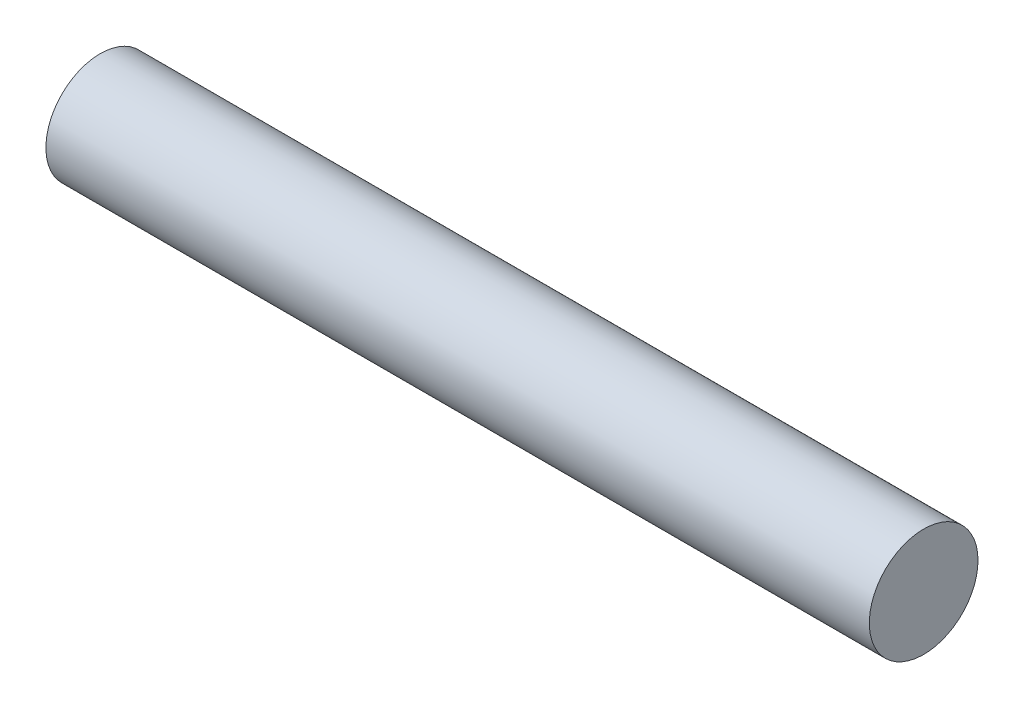
from build123d import *

# Parameters (mm, degrees)
SKETCH_1_R      = 1.65
EXTRUDE_1_DEPTH = 25


with BuildPart() as part:
    # 草图1 → 凸台-拉伸1 (new body)
    with BuildSketch(Plane(origin=(0, 0, 0), x_dir=(0, 0, -1), z_dir=(1, 0, 0))):
        Circle(SKETCH_1_R)
    extrude(amount=EXTRUDE_1_DEPTH)


solid = part.part
